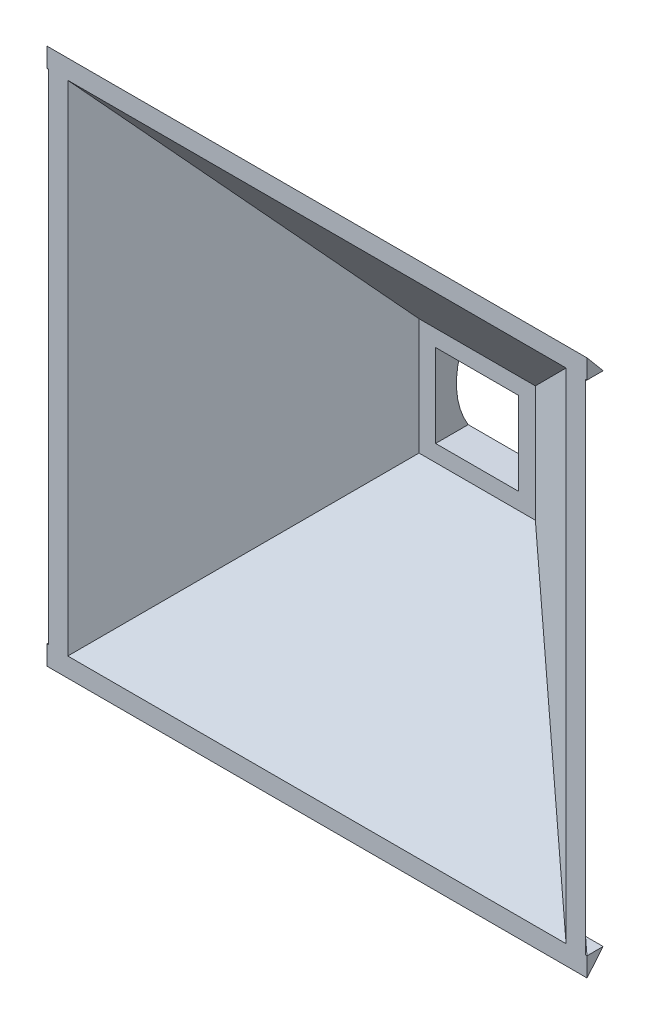
from build123d import *

# Parameters (mm, degrees)
SKETCH1_W           = 14
SKETCH1_H           = 14
SKETCH1_W_2         = 10
SKETCH1_H_2         = 10
BOSS_EXTRUDE1_DEPTH = 12
SKETCH2_R           = 9.5
CUT_EXTRUDE1_DEPTH  = 30
BOSS_EXTRUDE2_DEPTH = 30
BOSS_EXTRUDE3_DEPTH = 32.5
CUT_EXTRUDE2_DEPTH  = 79.125958548
CUT_EXTRUDE3_DEPTH  = 32.5
BOSS_EXTRUDE4_DEPTH = 32.5


with BuildPart() as part:
    # Sketch1 → Boss-Extrude1 (new body)
    with BuildSketch(Plane.XY):
        Rectangle(SKETCH1_W, SKETCH1_H)
        Rectangle(SKETCH1_W_2, SKETCH1_H_2, mode=Mode.SUBTRACT)
    extrude(amount=BOSS_EXTRUDE1_DEPTH)

    # Sketch2 → Cut-Extrude1 (cut)
    with BuildSketch(Plane(origin=(7, 0, 0), x_dir=(0, 0, -1), z_dir=(1, 0, 0))):
        Circle(SKETCH2_R)
    extrude(amount=-CUT_EXTRUDE1_DEPTH, mode=Mode.SUBTRACT)

    # Sketch4 → Boss-Extrude2 (add, symmetric)
    with BuildSketch(Plane(origin=(0, 0, 0), x_dir=(1, 0, 0), z_dir=(0, 1, 0))):
        Polygon((-7, -12), (-29.981333294, -31.283628291), (-32.293968462, -31.283628291), (-7, -10.059468683), align=None)
        Polygon((7, -10.059468683), (7, -12), (29.981333294, -31.283628291), (32.293968462, -31.283628291), align=None)
    extrude(amount=BOSS_EXTRUDE2_DEPTH, both=True)

    # Sketch6 → Boss-Extrude3 (add, symmetric)
    with BuildSketch(Plane(origin=(0, 0, 0), x_dir=(0, 0, -1), z_dir=(1, 0, 0))):
        Polygon((-10.059468683, -7), (-12, -7), (-31.283628291, -30), (-29.343096974, -30), align=None)
        Polygon((-31.283628291, 30), (-29.343096974, 30), (-10.059468683, 7), (-12, 7), align=None)
    extrude(amount=BOSS_EXTRUDE3_DEPTH, both=True)

    # Sketch7 → Cut-Extrude2 (cut, through all)
    with BuildSketch(Plane(origin=(32.5, 0, 0), x_dir=(0, 0, -1), z_dir=(1, 0, 0))):
        Polygon((-29.343096974, 30), (-10.059468683, 7), (-10.059468683, 30), align=None)
        Polygon((-29.343096974, -30), (-10.059468683, -7), (-10.059468683, -30), align=None)
    extrude(amount=-CUT_EXTRUDE2_DEPTH, mode=Mode.SUBTRACT)

    # Sketch9 → Cut-Extrude3 (cut, symmetric)
    with BuildSketch(Plane(origin=(0, 0, 0), x_dir=(1, 0, 0), z_dir=(0, 1, 0))):
        Polygon((-32.5, -31.283628291), (-7, -10.059468683), (-32.5, -10.059468683), align=None)
        Polygon((7, -10.059468683), (32.5, -10.059468683), (32.5, -31.283628291), align=None)
    extrude(amount=CUT_EXTRUDE3_DEPTH, both=True, mode=Mode.SUBTRACT)

    # Sketch10 → Boss-Extrude4 (add, symmetric)
    with BuildSketch(Plane(origin=(0, 0, 0), x_dir=(0, 0, -1), z_dir=(1, 0, 0))):
        Polygon((-31.283628291, -30), (-29.343096974, -30), (-31.283628291, -32.314513618), align=None)
        Polygon((-29.343096974, 30), (-31.283628291, 32.314513618), (-31.283628291, 30), align=None)
    extrude(amount=BOSS_EXTRUDE4_DEPTH, both=True)


solid = part.part
